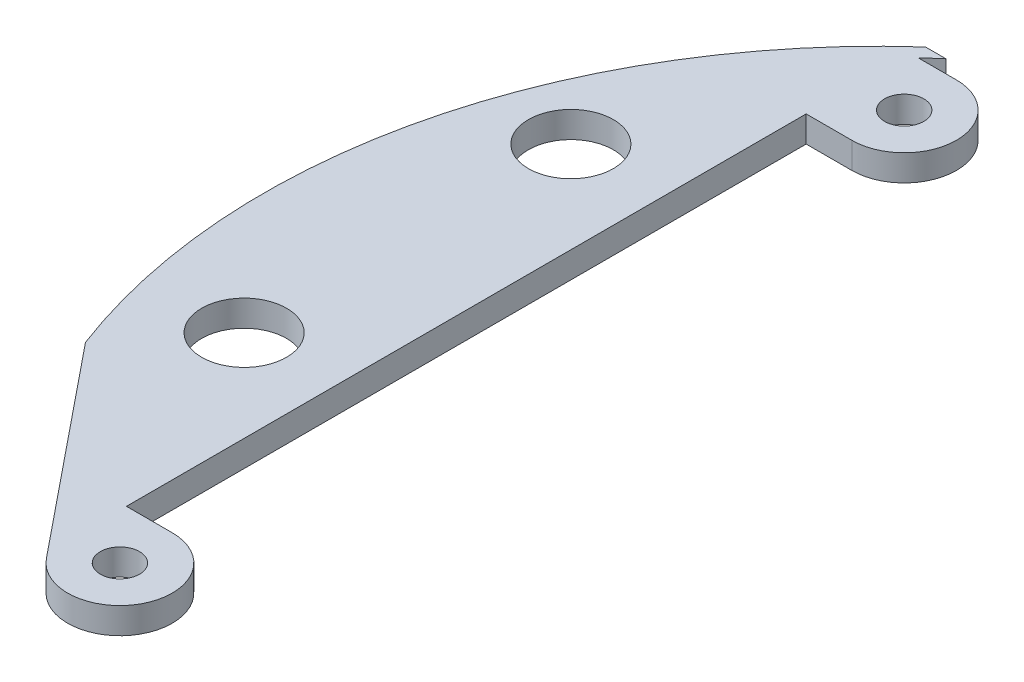
from build123d import *

# Parameters (mm, degrees)
SKETCH_1_W          = 20
SKETCH_1_H          = 70
SKETCH_1_R          = 1.5
SKETCH_1_W_2        = 6
SKETCH_1_H_2        = 52
EXTRUDE_1_DEPTH     = 2
SKETCH_2_W          = 0.5
SKETCH_2_H          = 26
CUT_EXTRUDE_1_DEPTH = 37.455452267
EXTRUDE_3_DEPTH     = 2
SKETCH_4_R          = 3.25
CUT_EXTRUDE_2_DEPTH = 40.874804075


with BuildPart() as part:
    # Эскиз1 → Бобышка-Вытянуть1 (new body)
    with BuildSketch(Plane(origin=(0, 0, 0), x_dir=(1, 0, 0), z_dir=(0, 1, 0))):
        Rectangle(SKETCH_1_W, SKETCH_1_H)
        with Locations(Location((0, 30, 0), (0, 0, 270))):
            Circle(SKETCH_1_R, mode=Mode.SUBTRACT)
        with Locations(Location((0, -30, 0), (0, 0, 270))):
            Circle(SKETCH_1_R, mode=Mode.SUBTRACT)
        Rectangle(SKETCH_1_W_2, SKETCH_1_H_2, mode=Mode.SUBTRACT)
    extrude(amount=EXTRUDE_1_DEPTH)

    # Эскиз2 → Вырез-Вытянуть1 (cut, through all)
    with BuildSketch(Plane(origin=(0, 2, 0), x_dir=(1, 0, 0), z_dir=(0, 1, 0))):
        with Locations((-3.25, -13)):
            Rectangle(SKETCH_2_W, SKETCH_2_H)
        with Locations((-3.25, 13)):
            Rectangle(SKETCH_2_W, SKETCH_2_H)
        with BuildLine():
            ThreePointArc((4, 30), (2.828427125, 27.171572875), (0, 26))
            Line((0, 26), (3, 26))
            Line((3, 26), (3, 0))
            Line((3, 0), (10, 0))
            Line((10, 0), (10, 35))
            Line((10, 35), (-1.801814511, 35))
            ThreePointArc((-1.801814511, 35), (-2.371833534, 34.50465844), (-2.933620688, 34))
            Line((-2.933620688, 34), (0, 34))
            ThreePointArc((0, 34), (2.828427125, 32.828427125), (4, 30))
        make_face()
        with BuildLine():
            ThreePointArc((-10, 27.658633372), (-7.367393186, 30.953957731), (-4.449961479, 34))
            ThreePointArc((-4.449961479, 34), (-3.913284985, 34.504235123), (-3.368774283, 35))
            Line((-3.368774283, 35), (-10, 35))
            Line((-10, 35), (-10, 27.658633372))
        make_face()
        with BuildLine():
            Line((10, 0), (3, 0))
            Line((3, 0), (3, -26))
            Line((3, -26), (0, -26))
            ThreePointArc((0, -26), (2.828427125, -27.171572875), (4, -30))
            ThreePointArc((4, -30), (1.336481718, -33.770121565), (-3.106908308, -32.519349274))
            Line((-3.106908308, -32.519349274), (-4.5, -30.80136273))
            Line((-4.5, -30.80136273), (-4.5, -32.5))
            ThreePointArc((-4.5, -32.5), (-3.175976694, -33.777056798), (-1.801814511, -35))
            Line((-1.801814511, -35), (10, -35))
            Line((10, -35), (10, 0))
        make_face()
        with BuildLine():
            Line((-4.5, -32.5), (-4.5, -30.80136273))
            Line((-4.5, -30.80136273), (-10, -24.018660595))
            Line((-10, -24.018660595), (-10, -35))
            Line((-10, -35), (-1.801814511, -35))
            ThreePointArc((-1.801814511, -35), (-3.175976694, -33.777056798), (-4.5, -32.5))
        make_face()
    extrude(amount=-CUT_EXTRUDE_1_DEPTH, mode=Mode.SUBTRACT)

    # Эскиз3 → Бобышка-Вытянуть3 (add)
    with BuildSketch(Plane(origin=(0, 2, 0), x_dir=(1, 0, 0), z_dir=(0, 1, 0))):
        with BuildLine():
            Line((-15.931618932, -16.703677979), (-10, -24.018660595))
            Line((-10, -24.018660595), (-10, 27.658633372))
            ThreePointArc((-10, 27.658633372), (-18.585418451, 6.228867289), (-15.931618932, -16.703677979))
        make_face()
    extrude(amount=-EXTRUDE_3_DEPTH)

    # Эскиз4 → Вырез-Вытянуть2 (cut, through all)
    with BuildSketch(Plane(origin=(0, 2, 0), x_dir=(1, 0, 0), z_dir=(0, 1, 0))):
        with Locations(Location((-10.5, 15, 0), (0, 0, 270))):
            Circle(SKETCH_4_R)
        with Locations(Location((-10.5, -10, 0), (0, 0, 270))):
            Circle(SKETCH_4_R)
    extrude(amount=-CUT_EXTRUDE_2_DEPTH, mode=Mode.SUBTRACT)


solid = part.part
